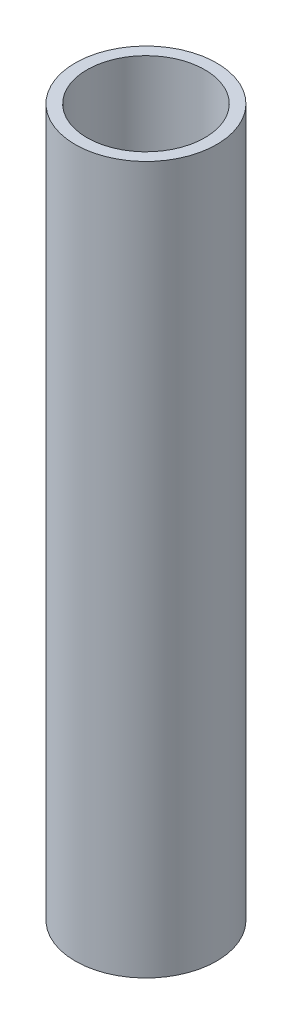
from build123d import *

# Parameters (mm, degrees)
SKETCH_1_R          = 3
EXTRUDE_1_DEPTH     = 30
SKETCH_2_R          = 2.5
CUT_EXTRUDE_1_DEPTH = 30


with BuildPart() as part:
    # Эскиз1 → Бобышка-Вытянуть1 (new body)
    with BuildSketch(Plane(origin=(0, 0, 0), x_dir=(1, 0, 0), z_dir=(0, 1, 0))):
        with Locations(Location((0, 0, 0), (0, 0, 270))):
            Circle(SKETCH_1_R)
    extrude(amount=EXTRUDE_1_DEPTH)

    # Эскиз2 → Вырез-Вытянуть1 (cut)
    with BuildSketch(Plane(origin=(0, 30, 0), x_dir=(1, 0, 0), z_dir=(0, 1, 0))):
        with Locations(Location((0, 0, 0), (0, 0, 270))):
            Circle(SKETCH_2_R)
    extrude(amount=-CUT_EXTRUDE_1_DEPTH, mode=Mode.SUBTRACT)


solid = part.part
